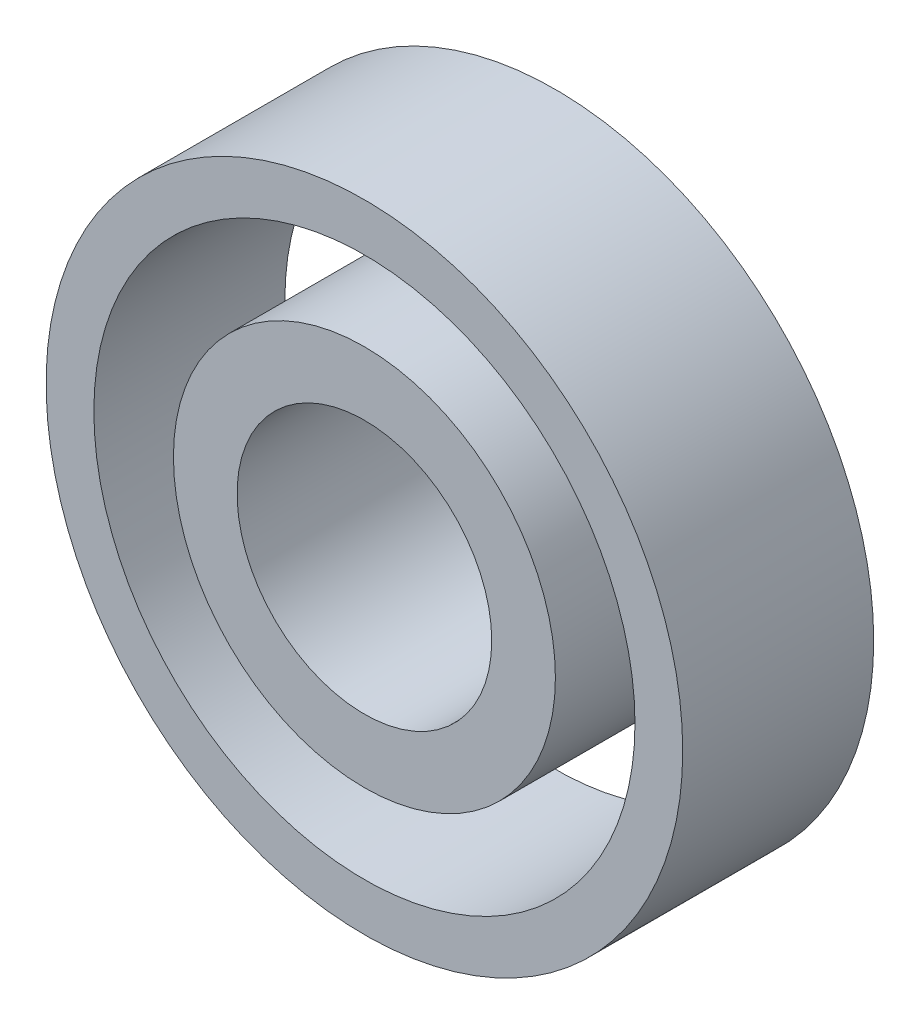
from build123d import *

# Parameters (mm, degrees)
SKETCH1_R           = 20
SKETCH1_R_2         = 17
BOSS_EXTRUDE1_DEPTH = 12
SKETCH2_R           = 12
SKETCH2_R_2         = 8
BOSS_EXTRUDE2_DEPTH = 12


with BuildPart() as part:
    # Sketch1 → Boss-Extrude1 (new body)
    with BuildSketch(Plane.XY):
        Circle(SKETCH1_R)
        Circle(SKETCH1_R_2, mode=Mode.SUBTRACT)
    extrude(amount=-BOSS_EXTRUDE1_DEPTH)


with BuildPart() as body_2:
    # Sketch2 → Boss-Extrude2 (new body)
    with BuildSketch(Plane.XY):
        Circle(SKETCH2_R)
        Circle(SKETCH2_R_2, mode=Mode.SUBTRACT)
    extrude(amount=-BOSS_EXTRUDE2_DEPTH)


solid = Compound([part.part, body_2.part])
